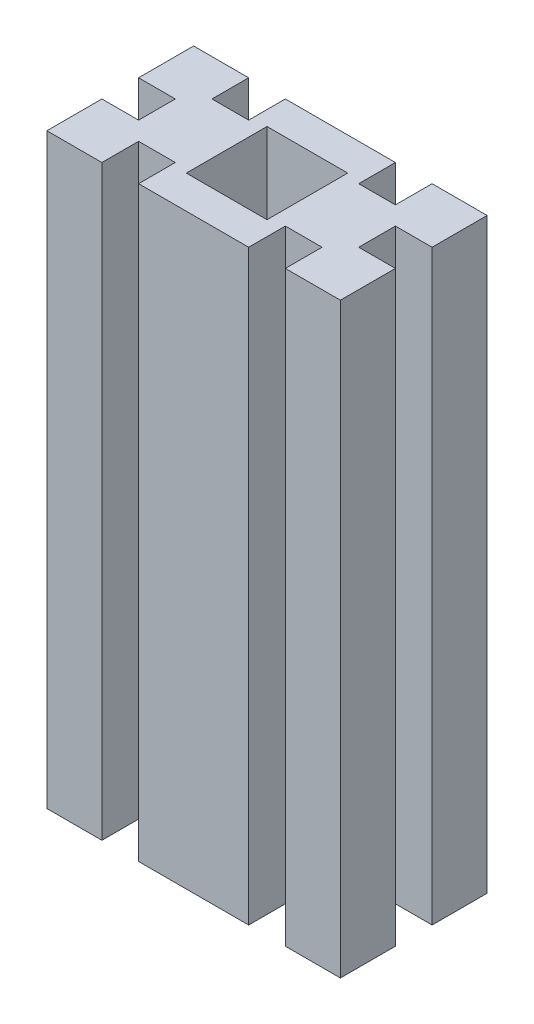
from build123d import *

# Parameters (mm, degrees)
SKETCH1_W       = 40
SKETCH1_H       = 20
BODY_DEPTH      = 80
SKETCH2_W       = 5
SKETCH2_H       = 5
SKETCH2_W_2     = 11
SKETCH2_H_2     = 11
PROFILAGE_DEPTH = 84.066238629


with BuildPart() as part:
    # Sketch1 → Body (new body)
    with BuildSketch(Plane(origin=(0, 0, 0), x_dir=(1, 0, 0), z_dir=(0, 1, 0))):
        Rectangle(SKETCH1_W, SKETCH1_H)
    extrude(amount=BODY_DEPTH)

    # Sketch2 → Profilage (cut, through all)
    with BuildSketch(Plane(origin=(0, 80, 0), x_dir=(1, 0, 0), z_dir=(0, 1, 0))):
        with Locations((-10, 7.5)):
            Rectangle(SKETCH2_W, SKETCH2_H)
        with Locations((-17.5, 0)):
            Rectangle(SKETCH2_W, SKETCH2_H)
        with Locations((-10, -7.5)):
            Rectangle(SKETCH2_W, SKETCH2_H)
        with Locations((10, -7.5)):
            Rectangle(SKETCH2_W, SKETCH2_H)
        with Locations((17.5, 0)):
            Rectangle(SKETCH2_W, SKETCH2_H)
        with Locations((10, 7.5)):
            Rectangle(SKETCH2_W, SKETCH2_H)
        Rectangle(SKETCH2_W_2, SKETCH2_H_2)
    extrude(amount=-PROFILAGE_DEPTH, mode=Mode.SUBTRACT)


solid = part.part
